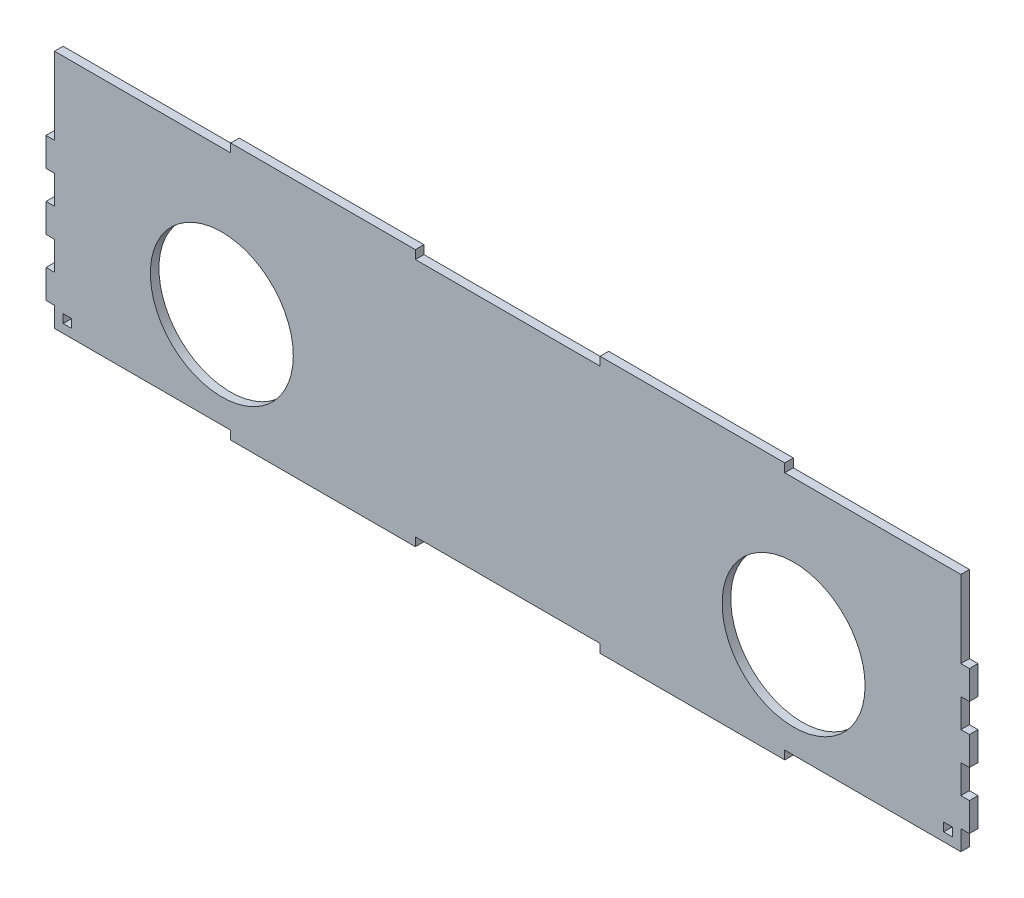
from build123d import *

# Parameters (mm, degrees)
SKETCH1_R           = 25
SKETCH1_W           = 3
SKETCH1_H           = 3
BOSS_EXTRUDE1_DEPTH = 3


with BuildPart() as part:
    # Sketch1 → Boss-Extrude1 (new body)
    with BuildSketch(Plane.XY):
        Polygon((3, 87), (3, 60), (0, 60), (0, 50), (3, 50), (3, 40), (0, 40), (0, 30), (3, 30), (3, 20), (0, 20), (0, 10), (3, 10), (3, 3), (64.6, 3), (64.6, 0), (129.2, 0), (129.2, 3), (193.8, 3), (193.8, 0), (258.4, 0), (258.4, 3), (320, 3), (320, 10), (323, 10), (323, 20), (320, 20), (320, 30), (323, 30), (323, 40), (320, 40), (320, 50), (323, 50), (323, 60), (320, 60), (320, 87), (258.4, 87), (258.4, 90), (193.8, 90), (193.8, 87), (129.2, 87), (129.2, 90), (64.6, 90), (64.6, 87), align=None)
        with Locations((61.5, 36.5)):
            Circle(SKETCH1_R, mode=Mode.SUBTRACT)
        with Locations((261.5, 36.5)):
            Circle(SKETCH1_R, mode=Mode.SUBTRACT)
        with Locations((315.5, 7.5)):
            Rectangle(SKETCH1_W, SKETCH1_H, mode=Mode.SUBTRACT)
        with Locations((7.5, 7.5)):
            Rectangle(SKETCH1_W, SKETCH1_H, mode=Mode.SUBTRACT)
    extrude(amount=BOSS_EXTRUDE1_DEPTH)


solid = part.part
